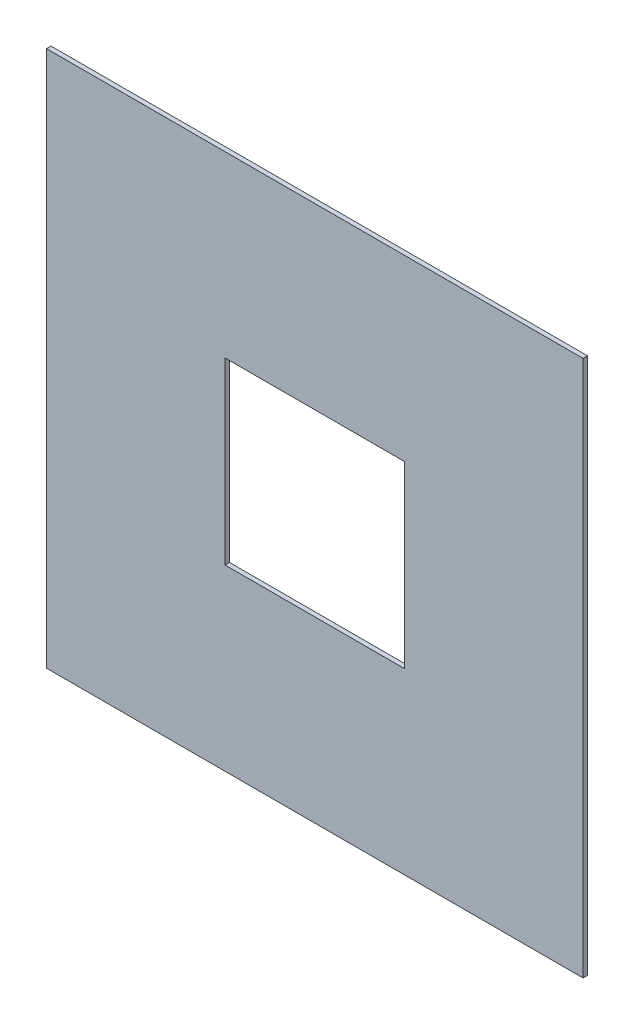
from build123d import *

# Parameters (mm, degrees)
SKETCH1_W           = 120
SKETCH1_H           = 120
SKETCH1_W_2         = 40.1
SKETCH1_H_2         = 40.1
BOSS_EXTRUDE1_DEPTH = 1


with BuildPart() as part:
    # Sketch1 → Boss-Extrude1 (new body)
    with BuildSketch(Plane.XY):
        Rectangle(SKETCH1_W, SKETCH1_H)
        Rectangle(SKETCH1_W_2, SKETCH1_H_2, mode=Mode.SUBTRACT)
    extrude(amount=BOSS_EXTRUDE1_DEPTH)


solid = part.part
